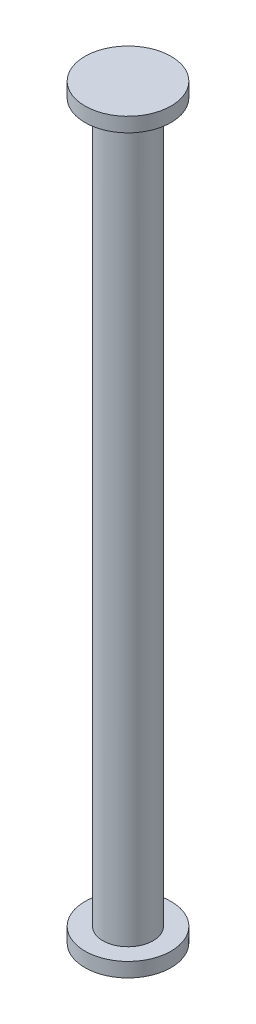
from build123d import *

# Parameters (mm, degrees)
SKETCH1_R           = 4.445
BOSS_EXTRUDE1_DEPTH = 127
SKETCH2_R           = 7.62
BOSS_EXTRUDE2_DEPTH = 2.54
BOSS_EXTRUDE3_START = 2.54
SKETCH3_R           = 7.62
BOSS_EXTRUDE3_DEPTH = 2.54


with BuildPart() as part:
    # Sketch1 → Boss-Extrude1 (new body)
    with BuildSketch(Plane(origin=(0, 0, 0), x_dir=(1, 0, 0), z_dir=(0, 1, 0))):
        with Locations(Location((0, 0, 0), (0, 0, 270))):
            Circle(SKETCH1_R)
    extrude(amount=BOSS_EXTRUDE1_DEPTH)

    # Sketch2 → Boss-Extrude2 (add)
    with BuildSketch(Plane.XZ):
        with Locations(Location((0, 0, 0), (0, 0, 270))):
            Circle(SKETCH2_R)
    extrude(amount=BOSS_EXTRUDE2_DEPTH)

    # Sketch3 → Boss-Extrude3 (add)
    with BuildSketch(Plane(origin=(0, 127, 0), x_dir=(1, 0, 0), z_dir=(0, 1, 0)).offset(BOSS_EXTRUDE3_START)):
        with Locations(Location((0, 0, 0), (0, 0, 90))):
            Circle(SKETCH3_R)
    extrude(amount=-BOSS_EXTRUDE3_DEPTH)


solid = part.part
